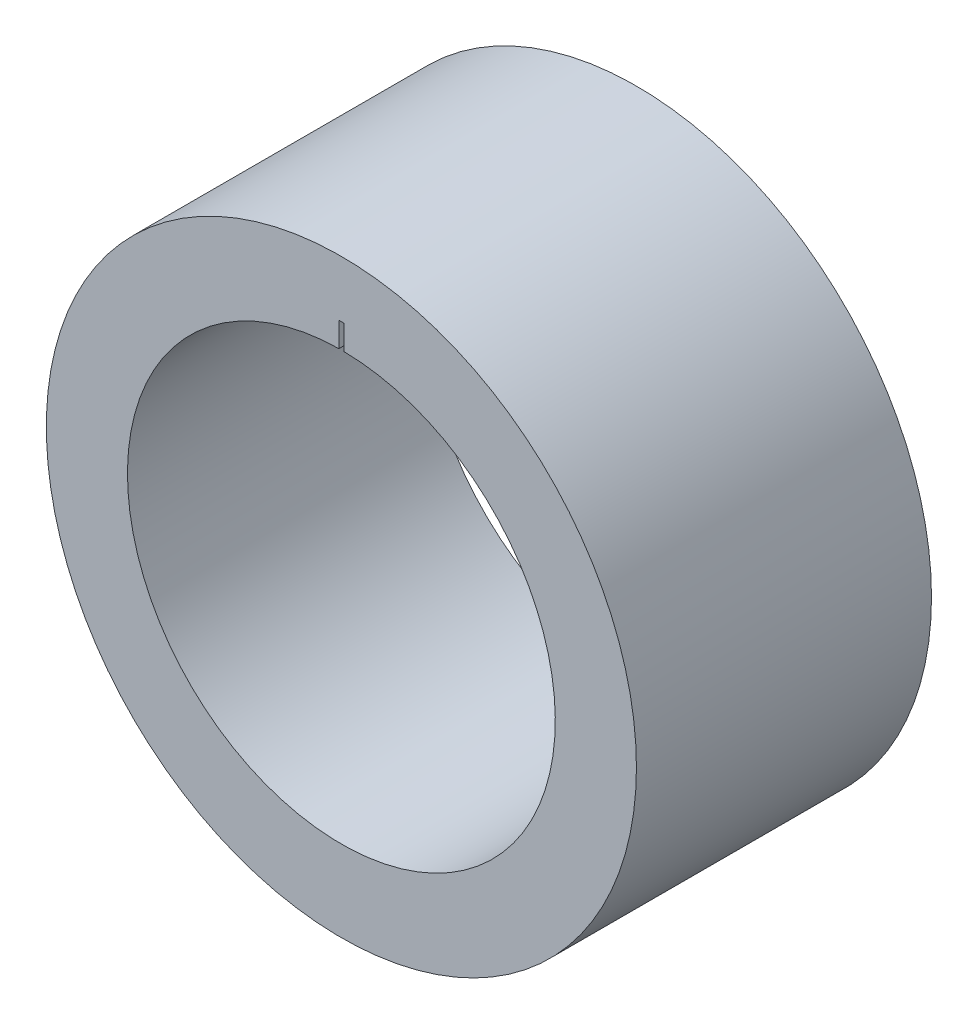
from build123d import *

# Parameters (mm, degrees)
SKETCH1_R        = 60
SKETCH1_R_2      = 43.5
EXTRUSION1_DEPTH = 60
EXTRUSION3_START = -60
EXTRUSION3_DEPTH = 60


with BuildPart() as part:
    # Sketch1 → Extrusion1 (new body)
    with BuildSketch(Plane.XY):
        Circle(SKETCH1_R)
        Circle(SKETCH1_R_2, mode=Mode.SUBTRACT)
    extrude(amount=EXTRUSION1_DEPTH)

    # Sketch3 → Extrusion3 (cut)
    with BuildSketch(Plane.XY.offset(60).offset(EXTRUSION3_START)):
        with BuildLine():
            Line((-0.5, 48.5), (-0.5, 43.497126342))
            ThreePointArc((-0.5, 43.497126342), (0, 43.5), (0.5, 43.497126342))
            Line((0.5, 43.497126342), (0.5, 48.5))
            Line((0.5, 48.5), (-0.5, 48.5))
        make_face()
    extrude(amount=EXTRUSION3_DEPTH, mode=Mode.SUBTRACT)


solid = part.part
